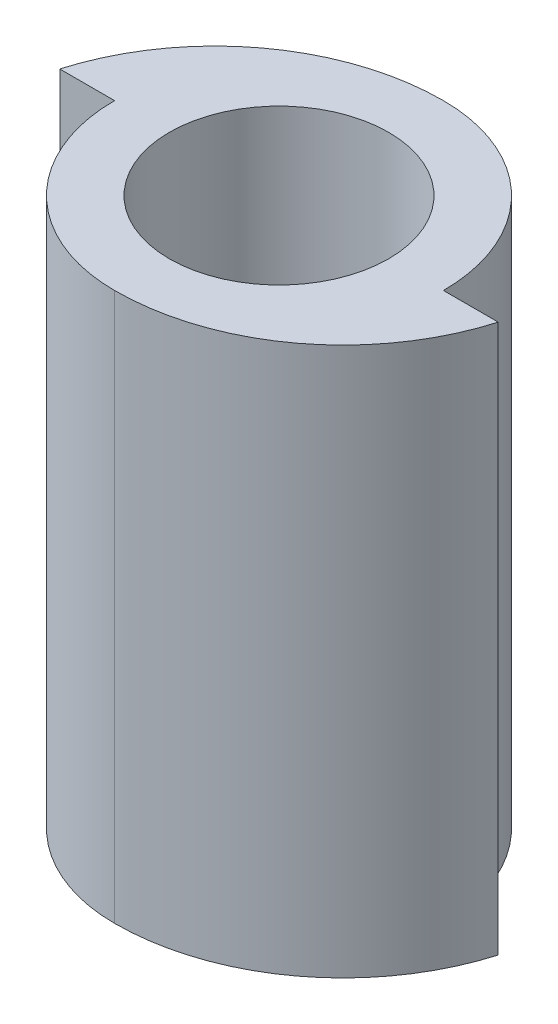
from build123d import *

# Parameters (mm, degrees)
EXTRUDE_1_DEPTH = 5


with BuildPart() as part:
    # 스케치2 → 보스-돌출1 (new body)
    with BuildSketch(Plane(origin=(0, 0, 0), x_dir=(1, 0, 0), z_dir=(0, 1, 0))):
        with BuildLine():
            ThreePointArc((-1, 0), (0, 1), (1, 0))
            Line((1, 0), (1.5, 0))
            ThreePointArc((1.5, 0), (1.060660172, 1.060660172), (0, 1.5))
            ThreePointArc((0, 1.5), (-1.060660172, 1.060660172), (-1.5, 0))
            Line((-1.5, 0), (-1, 0))
        make_face()
        with BuildLine():
            Line((1.5, 0), (1, 0))
            ThreePointArc((1, 0), (0, -1), (-1, 0))
            Line((-1, 0), (-1.5, 0))
            ThreePointArc((-1.5, 0), (-1.060660172, -1.060660172), (0, -1.5))
            ThreePointArc((0, -1.5), (1.060660172, -1.060660172), (1.5, 0))
        make_face()
        with BuildLine():
            Line((2, 0), (1.5, 0))
            ThreePointArc((1.5, 0), (1.060660172, -1.060660172), (0, -1.5))
            ThreePointArc((0, -1.5), (1.25, -1.083333333), (2, 0))
        make_face()
        with BuildLine():
            ThreePointArc((-1.5, 0), (-1.060660172, 1.060660172), (0, 1.5))
            ThreePointArc((0, 1.5), (-1.25, 1.083333333), (-2, 0))
            Line((-2, 0), (-1.5, 0))
        make_face()
    extrude(amount=EXTRUDE_1_DEPTH)


solid = part.part
